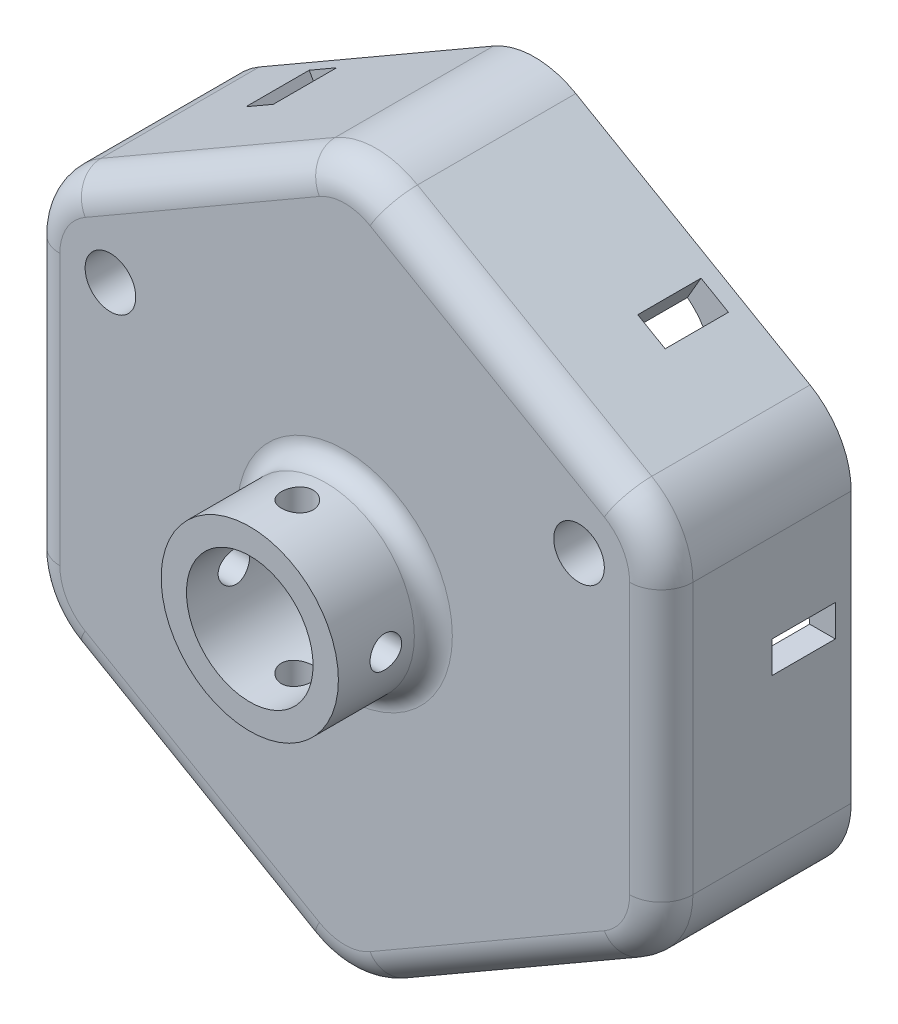
from build123d import *

# Parameters (mm, degrees)
SKETCH1_R           = 10
SKETCH1_R_2         = 4
BOSS_EXTRUDE1_DEPTH = 30
SKETCH2_R           = 14
CUT_EXTRUDE1_DEPTH  = 15
CUT_EXTRUDE2_DEPTH  = 10
FILLET1_R           = 10
SKETCH4_R           = 14
SKETCH4_R_2         = 10
BOSS_EXTRUDE2_DEPTH = 15
SKETCH5_R           = 2.5
CUT_EXTRUDE3_DEPTH  = 15
CIRPATTERN1_COUNT   = 2
CIRPATTERN1_ANGLE   = 90
FILLET2_R           = 3
SKETCH6_W           = 5
SKETCH6_H           = 10
CUT_EXTRUDE4_DEPTH  = 10
SKETCH7_W           = 10
SKETCH7_H           = 5
CUT_EXTRUDE5_DEPTH  = 10
FILLET3_R           = 13
FILLET4_R           = 5


with BuildPart() as part:
    # Sketch1 → Boss-Extrude1 (new body)
    with BuildSketch(Plane.XY):
        Polygon((50, -28.867513459), (50, 28.867513459), (0, 57.735026919), (-50, 28.867513459), (-50, -28.867513459), (0, -57.735026919), align=None)
        Circle(SKETCH1_R, mode=Mode.SUBTRACT)
        with Locations((-37.009618943, 21.367513459)):
            Circle(SKETCH1_R_2, mode=Mode.SUBTRACT)
        with Locations((37.009618943, 21.367513459)):
            Circle(SKETCH1_R_2, mode=Mode.SUBTRACT)
    extrude(amount=BOSS_EXTRUDE1_DEPTH)

    # Sketch2 → Cut-Extrude1 (cut)
    with BuildSketch(Plane(origin=(0, 0, 0), x_dir=(-1, 0, 0), z_dir=(0, 0, -1))):
        with BuildLine():
            Line((-46, 0), (-46, -26.558112383))
            Line((-46, -26.558112383), (0, -53.116224765))
            Line((0, -53.116224765), (46, -26.558112383))
            Line((46, -26.558112383), (46, 0))
            add(Edge.make_bspline(
                [(36.731454082, 13.372350903), (45.842186193, 13.055373541), (46, 3.651885762), (46, 0)],
                knots=[0, 0, 0, 0, 1, 1, 1, 1], degree=3))
            ThreePointArc((36.731454082, 13.372350903), (30.956978783, 16.136304509), (29.058463354, 22.250193916))
            add(Edge.make_bspline(
                [(29.058463354, 22.250193916), (30.079113466, 31.444175485), (32.195389033, 34.52820824), (23, 39.837168574)],
                knots=[0, 0, 0, 0, 1, 1, 1, 1], degree=3))
            Line((23, 39.837168574), (0, 53.116224765))
            Line((0, 53.116224765), (-23, 39.837168574))
            add(Edge.make_bspline(
                [(-29.058463354, 22.250193916), (-30.079113466, 31.444175485), (-32.195389033, 34.52820824), (-23, 39.837168574)],
                knots=[0, 0, 0, 0, 1, 1, 1, 1], degree=3))
            ThreePointArc((-29.058463354, 22.250193916), (-29.021839379, 21.80952889), (-29.009618943, 21.367513459))
            ThreePointArc((-29.009618943, 21.367513459), (-31.255258905, 15.809875422), (-36.731454082, 13.372350903))
            add(Edge.make_bspline(
                [(-36.731454082, 13.372350903), (-45.842186193, 13.055373541), (-46, 3.651885762), (-46, 0)],
                knots=[0, 0, 0, 0, 1, 1, 1, 1], degree=3))
        make_face()
        Circle(SKETCH2_R, mode=Mode.SUBTRACT)
    extrude(amount=-CUT_EXTRUDE1_DEPTH, mode=Mode.SUBTRACT)

    # Sketch3 → Cut-Extrude2 (cut)
    with BuildSketch(Plane(origin=(0, 0, 15), x_dir=(-1, 0, 0), z_dir=(0, 0, -1))):
        Polygon((0, -53.116224765), (25.5, -38.393792901), (25.5, -17.393792901), (-25.5, -17.393792901), (-25.5, -38.393792901), align=None)
    extrude(amount=-CUT_EXTRUDE2_DEPTH, mode=Mode.SUBTRACT)

    # Fillet1
    fillet1_edges = [part.edges().sort_by_distance(p)[0] for p in [
        (-46, -26.558112383, 7.5),
        (0, -53.116224765, 12.5),
        (46, -26.558112383, 7.5),
        (0, 53.116224765, 7.5),
    ]]
    fillet(fillet1_edges, radius=FILLET1_R)

    # Sketch4 → Boss-Extrude2 (add)
    with BuildSketch(Plane.XY.offset(30)):
        with Locations(Location((0, 0, 0), (0, 0, 180))):
            Circle(SKETCH4_R)
        Circle(SKETCH4_R_2, mode=Mode.SUBTRACT)
    extrude(amount=BOSS_EXTRUDE2_DEPTH)

    # Sketch5 → Cut-Extrude3 (cut, symmetric)
    with BuildSketch(Plane(origin=(0, 0, 0), x_dir=(0, 0, -1), z_dir=(1, 0, 0))):
        with Locations((-37.5, 0)):
            Circle(SKETCH5_R)
        with Locations((-7.5, 0)):
            Circle(SKETCH5_R)
    cut_extrude3 = extrude(amount=CUT_EXTRUDE3_DEPTH, both=True, mode=Mode.SUBTRACT)

    # CirPattern1: Cut-Extrude3 ×2 about axis
    cirpattern1_axis = Axis((0, 0, 45), (0, 0, 1))
    for i in range(1, CIRPATTERN1_COUNT):
        add(cut_extrude3.rotate(cirpattern1_axis, i * CIRPATTERN1_ANGLE / (CIRPATTERN1_COUNT - 1)), mode=Mode.SUBTRACT)

    # Fillet2
    fillet2_edges = [part.edges().sort_by_distance(p)[0] for p in [
        (14, 0, 30),
        (14, 0, 15),
    ]]
    fillet(fillet2_edges, radius=FILLET2_R)

    # Sketch6 → Cut-Extrude4 (cut)
    with BuildSketch(Plane(origin=(25, 43.301270189, 0), x_dir=(0.8660254037844387, -0.49999999999999983, 0), z_dir=(0.49999999999999983, 0.8660254037844387, 0))):
        with Locations((6.867513459, -7.5)):
            Rectangle(SKETCH6_W, SKETCH6_H)
    cut_extrude4 = extrude(amount=-CUT_EXTRUDE4_DEPTH, mode=Mode.SUBTRACT)

    # Sketch7 → Cut-Extrude5 (cut)
    with BuildSketch(Plane(origin=(50, 0, 0), x_dir=(0, 0, -1), z_dir=(1, 0, 0))):
        with Locations((-7.5, 4.867513459)):
            Rectangle(SKETCH7_W, SKETCH7_H)
    cut_extrude5 = extrude(amount=-CUT_EXTRUDE5_DEPTH, mode=Mode.SUBTRACT)

    # Mirror1: Cut-Extrude4, Cut-Extrude5 across plane
    add(cut_extrude4.mirror(Plane(origin=(0, 0, 0), x_dir=(0, 0, 1), z_dir=(1, 0, 0))), mode=Mode.SUBTRACT)
    add(cut_extrude5.mirror(Plane(origin=(0, 0, 0), x_dir=(0, 0, 1), z_dir=(1, 0, 0))), mode=Mode.SUBTRACT)

    # Fillet3
    fillet3_edges = [part.edges().sort_by_distance(p)[0] for p in [
        (0, -57.735026919, 15),
        (-50, -28.867513459, 15),
        (-50, 28.867513459, 15),
        (0, 57.735026919, 15),
        (50, 28.867513459, 15),
        (50, -28.867513459, 15),
    ]]
    fillet(fillet3_edges, radius=FILLET3_R)

    # Fillet4
    fillet4_edges = [part.edges().sort_by_distance(p)[0] for p in [
        (-50, 0, 30),
        (-25, 43.301270189, 30),
        (25, -43.301270189, 30),
        (50, 0, 30),
        (25, 43.301270189, 30),
        (-25, -43.301270189, 30),
        (0, 55.72391992, 30),
        (48.258330249, 27.86195996, 30),
        (48.258330249, -27.86195996, 30),
        (0, -55.72391992, 30),
        (-48.258330249, -27.86195996, 30),
        (-48.258330249, 27.86195996, 30),
    ]]
    fillet(fillet4_edges, radius=FILLET4_R)


solid = part.part
